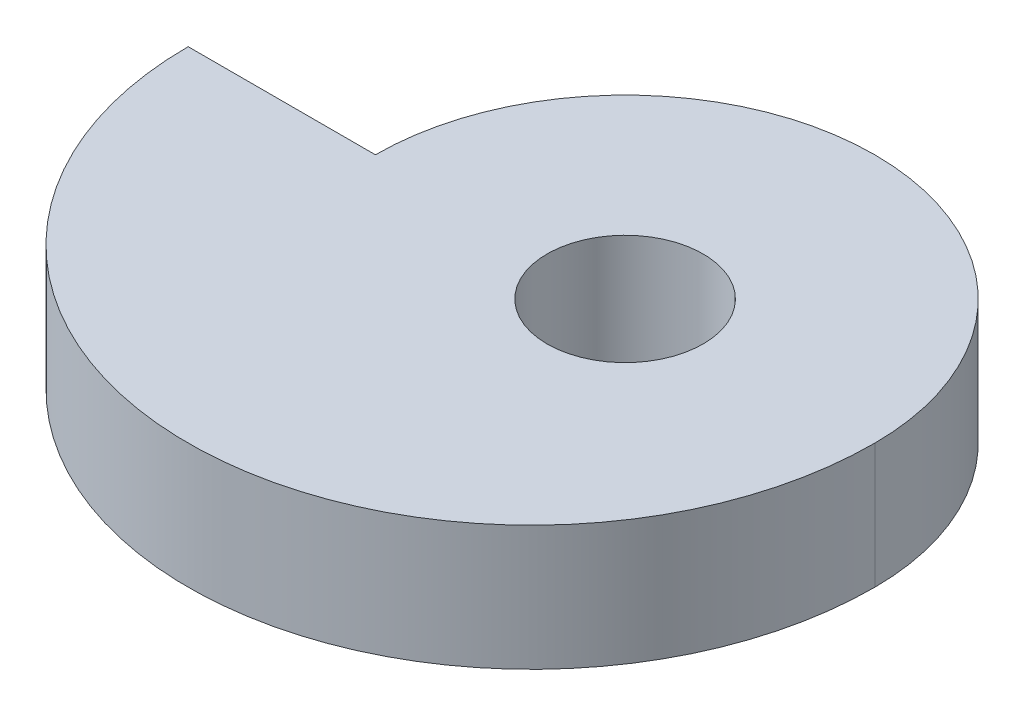
from build123d import *

# Parameters (mm, degrees)
SKETCH1_R           = 1.5875
BOSS_EXTRUDE1_DEPTH = 2.54


with BuildPart() as part:
    # Sketch1 → Boss-Extrude1 (new body)
    with BuildSketch(Plane(origin=(0, 0, 0), x_dir=(1, 0, 0), z_dir=(0, 1, 0))):
        with BuildLine():
            Line((-8.89, 0), (-5.08, 0))
            ThreePointArc((-5.08, 0), (0, 5.08), (5.08, 0))
            ThreePointArc((5.08, 0), (-1.905, -6.985), (-8.89, 0))
        make_face()
        with Locations(Location((0, 0, 0), (0, 0, 270))):
            Circle(SKETCH1_R, mode=Mode.SUBTRACT)
    extrude(amount=BOSS_EXTRUDE1_DEPTH)


solid = part.part
